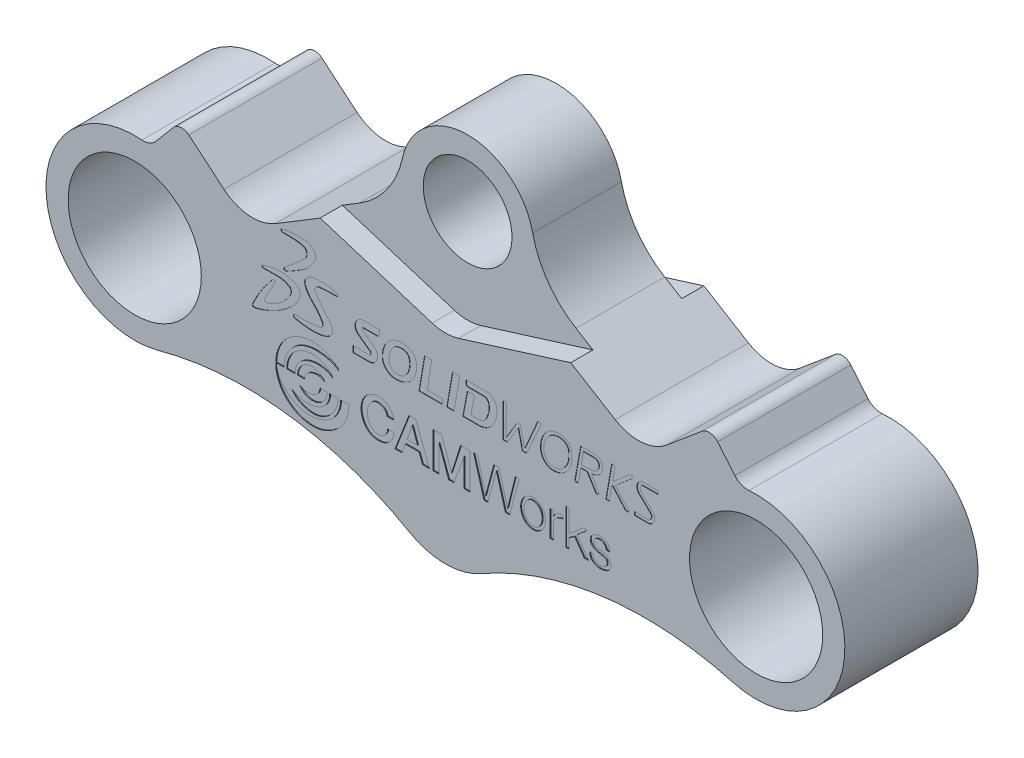
from build123d import *

# Parameters (mm, degrees)
BOSS_EXTRUDE1_DEPTH         = 9.525
FILLET19_R                  = 6.35
FILLET20_R                  = 1.5875
CUT_EXTRUDE2_DEPTH          = 3.175
FILLET9_R                   = 6.35
FILLET14_R                  = 6.35
F_1_2_0_5_DIAMETER_HOLE1_D  = 12.7
F_3_4_0_75_DIAMETER_HOLE1_D = 19.05
CUT_EXTRUDE7_DEPTH          = 0.127
CUT_EXTRUDE9_DEPTH          = 0.0508


with BuildPart() as part:
    # Sketch1 → Boss-Extrude1 (new, symmetric)
    with BuildSketch(Plane.XY):
        with BuildLine():
            Line((41.408094092, 21.341782887), (37.922855541, 25.495328451))
            Line((37.922855541, 25.495328451), (28.194091114, 17.331925808))
            Line((28.194091114, 17.331925808), (15.505038662, 25.045968696))
            ThreePointArc((15.505038662, 25.045968696), (11.511601045, 28.76173019), (9.311946254, 33.753317741))
            ThreePointArc((9.311946254, 33.753317741), (0, 41.275), (-9.311946254, 33.753317741))
            ThreePointArc((-9.311946254, 33.753317741), (-11.511601045, 28.76173019), (-15.505038662, 25.045968696))
            Line((-15.505038662, 25.045968696), (-28.194091114, 17.331925808))
            Line((-28.194091114, 17.331925808), (-37.922855541, 25.495328451))
            Line((-37.922855541, 25.495328451), (-41.408094092, 21.341782887))
            ThreePointArc((-41.408094092, 21.341782887), (-42.315924102, 20.673762154), (-43.429041923, 20.496630161))
            ThreePointArc((-43.429041923, 20.496630161), (-57.093834015, 6.644645276), (-41.079126513, -4.4067425))
            ThreePointArc((-41.079126513, -4.4067425), (-22.650036169, -3.088337931), (-5.129488876, -8.953487892))
            ThreePointArc((-5.129488876, -8.953487892), (0, -10.31875), (5.129488876, -8.953487892))
            ThreePointArc((5.129488876, -8.953487892), (22.650036169, -3.088337931), (41.079126513, -4.4067425))
            ThreePointArc((41.079126513, -4.4067425), (57.093834015, 6.644645276), (43.429041923, 20.496630161))
            ThreePointArc((43.429041923, 20.496630161), (42.315924102, 20.673762154), (41.408094092, 21.341782887))
        make_face()
    extrude(amount=BOSS_EXTRUDE1_DEPTH, both=True)

    # Fillet19
    fillet19_edges = [part.edges().sort_by_distance(p)[0] for p in [
        (28.194091114, 17.331925808, 0),
        (-28.194091114, 17.331925808, 0),
    ]]
    fillet(fillet19_edges, radius=FILLET19_R)

    # Fillet20
    fillet20_edges = [part.edges().sort_by_distance(p)[0] for p in [
        (37.922855541, 25.495328451, 0),
        (-37.922855541, 25.495328451, 0),
    ]]
    fillet(fillet20_edges, radius=FILLET20_R)

    # Sketch3 → Cut-Extrude2 (cut)
    with BuildSketch(Plane.XY.offset(9.525)):
        Polygon((-13.038987616, 44.246461893), (13.038987616, 44.246461893), (19.347324486, 24.017827298), (0, 17.984328605), (-19.347324486, 24.017827298), align=None)
    cut_extrude2 = extrude(amount=-CUT_EXTRUDE2_DEPTH, mode=Mode.SUBTRACT)

    # Fillet9
    fillet9_edges = [part.edges().sort_by_distance(p)[0] for p in [
        (0, 17.984328605, 7.9375),
    ]]
    fillet(fillet9_edges, radius=FILLET9_R)

    # Mirror13: Cut-Extrude2 across plane
    add(cut_extrude2.mirror(Plane.XY), mode=Mode.SUBTRACT)

    # Fillet14
    fillet14_edges = [part.edges().sort_by_distance(p)[0] for p in [
        (0, 17.984328605, -7.9375),
    ]]
    fillet(fillet14_edges, radius=FILLET14_R)

    # 1/2 (0.5) Diameter Hole1 (through all)
    with Locations(Plane.XY.offset(6.35)):
        with Locations((0, 31.75)):
            Hole(F_1_2_0_5_DIAMETER_HOLE1_D / 2)

    # 3/4 (0.75) Diameter Hole1 (through all)
    with Locations(Plane.XY.offset(9.525)):
        with Locations((-44.45, 7.837734292), (44.45, 7.837734292)):
            Hole(F_3_4_0_75_DIAMETER_HOLE1_D / 2)

    # Sketch20 → Cut-Extrude7 (cut)
    # profile 1 of 14: a face of its own
    with BuildSketch(Plane.XY.offset(9.525)):
        with BuildLine():
            add(Edge.make_bspline(
                [(-15.154845135, 5.962788169), (-15.578325694, 6.549836748), (-16.837528358, 7.448350373), (-18.961648523, 7.893001053), (-21.069184277, 7.44815324), (-23.412076262, 5.965768414), (-24.265528194, 3.858612653), (-24.26129315, 2.50635141)],
                knots=[0, 0, 0, 0, 0.17213689, 0.357725167, 0.501202943, 0.677745934, 1, 1, 1, 1], degree=3))
            Line((-24.26129315, 2.50635141), (-23.102441304, 2.50635141))
            add(Edge.make_bspline(
                [(-23.102441304, 2.50635141), (-23.097069308, 3.585922671), (-22.465123157, 5.225124628), (-20.549082761, 6.630138944), (-18.078018823, 7.11116476), (-16.196628222, 6.603943369), (-15.154845135, 5.962788169)],
                knots=[0, 0, 0, 0, 0.304366873, 0.466255188, 0.655370709, 1, 1, 1, 1], degree=3))
        make_face()
    # profile 2 of 14: a face of its own
    with BuildSketch(Plane.XY.offset(9.525)):
        with BuildLine():
            add(Edge.make_bspline(
                [(-17.245831982, 3.573554363), (-17.405493774, 3.905784033), (-17.976863302, 4.443993085), (-19.102146716, 4.703055663), (-20.533477397, 4.26164477), (-21.166460236, 3.22922874), (-21.137142585, 2.50635141)],
                knots=[0, 0, 0, 0, 0.202686739, 0.415279372, 0.607942049, 1, 1, 1, 1], degree=3))
            Line((-21.137142585, 2.50635141), (-20.130284256, 2.50635141))
            add(Edge.make_bspline(
                [(-20.130284256, 2.50635141), (-20.132402551, 2.959336263), (-19.632556635, 3.697544249), (-18.387076421, 4.036630122), (-17.576838627, 3.870423003), (-17.245831982, 3.573554363)],
                knots=[0, 0, 0, 0, 0.355167201, 0.653312356, 1, 1, 1, 1], degree=3))
        make_face()
    # profile 3 of 14: a face of its own
    with BuildSketch(Plane.XY.offset(9.525)):
        with BuildLine():
            add(Edge.make_bspline(
                [(-16.102800636, 4.673722033), (-16.659437016, 5.444632506), (-18.079126836, 6.325446328), (-20.165970666, 6.088538818), (-22.036821611, 5.05274492), (-22.715448931, 3.5248993), (-22.698757178, 2.50635141)],
                knots=[0, 0, 0, 0, 0.31313644, 0.50236644, 0.666443794, 1, 1, 1, 1], degree=3))
            Line((-22.698757178, 2.50635141), (-21.501624941, 2.50635141))
            add(Edge.make_bspline(
                [(-21.501624941, 2.50635141), (-21.58787462, 3.339798662), (-20.852406345, 4.588240409), (-19.121551814, 5.300006211), (-17.541941229, 5.311625203), (-16.553941295, 4.965750914), (-16.102800636, 4.673722033)],
                knots=[0, 0, 0, 0, 0.336821708, 0.56234389, 0.77094482, 1, 1, 1, 1], degree=3))
        make_face()
    # profile 4 of 14: a face of its own
    with BuildSketch(Plane.XY.offset(9.525)):
        with BuildLine():
            add(Edge.make_bspline(
                [(-20.829642183, 1.435482139), (-20.572440719, 0.981143184), (-19.817018621, 0.39467993), (-18.506105431, 0.377938727), (-17.301557854, 1.001109629), (-16.936098719, 1.96152892), (-16.928176734, 2.50635141)],
                knots=[0, 0, 0, 0, 0.28773554, 0.487574045, 0.695315024, 1, 1, 1, 1], degree=3))
            Line((-16.928176734, 2.50635141), (-17.959997916, 2.50635141))
            add(Edge.make_bspline(
                [(-17.959997916, 2.50635141), (-17.932048156, 1.82229001), (-19.008250224, 0.918546675), (-20.325645903, 1.043272546), (-20.829642183, 1.435482139)],
                knots=[0, 0, 0, 0, 0.49957784, 1, 1, 1, 1], degree=3))
        make_face()
    # profile 5 of 14: a face of its own
    with BuildSketch(Plane.XY.offset(9.525)):
        with BuildLine():
            add(Edge.make_bspline(
                [(-21.960424075, 0.342894049), (-21.534887241, -0.33617705), (-20.396288729, -1.012603155), (-18.535853049, -1.270982252), (-16.953146819, -0.656844224), (-15.733028159, 0.67661153), (-15.315960834, 1.862935087), (-15.408189038, 2.50635141)],
                knots=[0, 0, 0, 0, 0.257454808, 0.416874859, 0.605260486, 0.789877863, 1, 1, 1, 1], degree=3))
            Line((-15.408189038, 2.50635141), (-16.561806986, 2.50635141))
            add(Edge.make_bspline(
                [(-16.561806986, 2.50635141), (-16.511471384, 1.837059498), (-16.970201644, 0.679921892), (-18.401425093, -0.117874782), (-20.081264669, -0.401578151), (-21.309848105, -0.079997861), (-21.960424075, 0.342894049)],
                knots=[0, 0, 0, 0, 0.283056269, 0.482539175, 0.671247526, 1, 1, 1, 1], degree=3))
        make_face()
    # profile 6 of 14: a face of its own
    with BuildSketch(Plane.XY.offset(9.525)):
        with BuildLine():
            add(Edge.make_bspline(
                [(15.441899323, 2.693396798), (15.602035462, 2.902756432), (15.892726972, 3.462988431), (16.505400437, 3.609425693), (16.816078844, 3.615328702)],
                knots=[0, 0, 0, 0, 0.469307206, 1, 1, 1, 1], degree=3))
            Line((16.816078844, 3.615328702), (16.816078844, 4.127474505))
            add(Edge.make_bspline(
                [(16.816078844, 4.127474505), (16.275543308, 4.160186671), (15.691235328, 3.837714188), (15.441899323, 3.313429427)],
                knots=[0, 0, 0, 0, 1, 1, 1, 1], degree=3))
            Line((15.441899323, 3.313429427), (15.441899323, 4.031351101))
            Line((15.441899323, 4.031351101), (14.97561702, 4.031351101))
            Line((14.97561702, 4.031351101), (14.97561702, 0.3485751))
            Line((14.97561702, 0.3485751), (15.441899323, 0.3485751))
            Line((15.441899323, 0.3485751), (15.441899323, 2.693396798))
        make_face()
    # profile 7 of 14: a face of its own
    with BuildSketch(Plane.XY.offset(9.525)):
        with BuildLine():
            add(Edge.make_bspline(
                [(20.67107786, 1.528216872), (20.613953375, 1.221655034), (20.797858839, 0.647667647), (21.670749301, 0.165116883), (22.628151326, 0.131819602), (23.655705249, 0.624849989), (23.804693391, 1.669908639), (23.003932649, 2.450890522), (22.141467227, 2.455105406), (21.281007437, 2.701487333), (21.206579975, 3.530333453), (21.845868185, 3.724427066), (22.610636197, 3.788981938), (23.027282351, 3.128969869), (23.036675624, 2.906141513)],
                knots=[0, 0, 0, 0, 0.091070615, 0.156874293, 0.280394799, 0.36488583, 0.466496103, 0.536468143, 0.665478679, 0.716572617, 0.778127638, 0.846119657, 0.890812251, 1, 1, 1, 1], degree=3))
            Line((23.036675624, 2.906141513), (23.49122029, 2.906141513))
            add(Edge.make_bspline(
                [(23.49122029, 2.906141513), (23.50687304, 3.302073861), (23.43770383, 3.574529519), (22.817415308, 4.130123172), (22.063336854, 4.200612601), (21.439105471, 4.112384908), (20.79617851, 3.6676207), (20.604844787, 2.868148864), (21.420153209, 2.029246431), (22.299125952, 2.019386461), (23.104530145, 1.719891976), (23.279304278, 1.022216597), (22.557776527, 0.550353966), (21.619512601, 0.581079625), (21.000875285, 1.120489437), (21.119649084, 1.528216872)],
                knots=[0, 0, 0, 0, 0.067061893, 0.148974799, 0.203040078, 0.28681956, 0.328691497, 0.425200419, 0.488568397, 0.640215096, 0.674333456, 0.728187294, 0.813903484, 0.886702844, 1, 1, 1, 1], degree=3))
            Line((21.119649084, 1.528216872), (20.67107786, 1.528216872))
        make_face()
    # profile 8 of 14: a face of its own
    with BuildSketch(Plane.XY.offset(9.525)):
        with BuildLine():
            add(Edge.make_bspline(
                [(-8.253737619, 2.278747085), (-8.261737772, 1.726367618), (-8.894810308, 0.803328862), (-10.146225272, 0.954264904), (-10.822225065, 1.514190474), (-11.231846307, 2.528922229), (-11.160611268, 3.826486548), (-10.127154363, 4.983623712), (-8.783774058, 4.762476757), (-8.363145772, 4.08237895), (-8.346465372, 3.792109582)],
                knots=[0, 0, 0, 0, 0.179682053, 0.286072628, 0.363963482, 0.4521715, 0.627882231, 0.757862959, 0.910918307, 1, 1, 1, 1], degree=3))
            Line((-8.346465372, 3.792109582), (-7.409708046, 3.792109582))
            add(Edge.make_bspline(
                [(-7.409708046, 3.792109582), (-7.461206133, 4.665433762), (-8.60299766, 5.763666694), (-10.334564404, 5.595248979), (-11.617114969, 4.812707555), (-12.19649888, 3.344718515), (-11.934060251, 1.63556273), (-11.070868107, 0.46369399), (-9.677060812, 0.085191867), (-8.29345954, 0.305226166), (-7.493922171, 1.389534833), (-7.351601244, 2.056390727), (-7.374414812, 2.278747085)],
                knots=[0, 0, 0, 0, 0.175330696, 0.271236919, 0.338579899, 0.473109905, 0.57073625, 0.688740776, 0.747216662, 0.858562083, 0.957456763, 1, 1, 1, 1], degree=3))
            Line((-7.374414812, 2.278747085), (-8.253737619, 2.278747085))
        make_face()
    # profile 9 of 14: a face of its own
    with BuildSketch(Plane.XY.offset(9.525)):
        Polygon((1.210832331, 0.3485751), (2.681056399, 4.343364089), (2.681056399, 0.3485751), (3.493396608, 0.3485751), (3.493396608, 5.457765475), (2.178928778, 5.457765475), (0.889354837, 1.40777763), (-0.57144251, 5.461001415), (-1.763817842, 5.461001415), (-1.763817842, 0.3485751), (-0.919861843, 0.3485751), (-0.919861843, 4.212080427), (0.472560247, 0.3485751), align=None)
    # profile 10 of 14: a face of its own
    with BuildSketch(Plane.XY.offset(9.525)):
        with BuildLine():
            add(Edge.make_bspline(
                [(-14.997707795, 2.50635141), (-14.98648072, 1.545350159), (-15.729691015, -0.601005149), (-18.510422409, -1.76504958), (-21.465048224, -1.422639309), (-23.60016443, 0.183714613), (-24.167802042, 1.926466653), (-24.206631157, 2.489048279)],
                knots=[0.001261012, 0.001261012, 0.001261012, 0.001261012, 0.216474276, 0.470315596, 0.597834181, 0.876935572, 1, 1, 1, 1], degree=3))
            Line((-24.206631157, 2.489048279), (-24.261798656, 2.489048279))
            add(Edge.make_bspline(
                [(-24.261798656, 2.489048279), (-24.269621802, 2.203115398), (-24.21864849, 1.407758141), (-23.839857018, 0.20666636), (-22.824455842, -1.274247865), (-20.904580847, -2.645070192), (-18.171617334, -2.928579089), (-16.051476509, -1.889375611), (-14.327745425, -0.224233421), (-13.777862041, 1.416031905), (-13.802751288, 2.50635141)],
                knots=[0, 0, 0, 0, 0.05256655, 0.14551147, 0.227178518, 0.378977625, 0.564372139, 0.699237559, 0.80001659, 0.998939544, 0.998939544, 0.998939544, 0.998939544], degree=3))
            Line((-13.802751288, 2.50635141), (-14.997707795, 2.50635141))
        make_face()
    # profile 11 of 14: a face of its own
    with BuildSketch(Plane.XY.offset(9.525)):
        Polygon((-6.239149138, 0.3485751), (-5.728469786, 1.660665445), (-3.755280049, 1.660665445), (-3.260193959, 0.3485751), (-2.295667713, 0.3485751), (-4.224720206, 5.461001415), (-5.212030536, 5.461001415), (-7.201840588, 0.3485751), align=None)
        Polygon((-5.468142485, 2.391298414), (-4.741874917, 4.510218278), (-3.988781582, 2.391298414), align=None, mode=Mode.SUBTRACT)
    # profile 12 of 14: a face of its own
    with BuildSketch(Plane.XY.offset(9.525)):
        Polygon((17.215169145, 5.461001415), (17.215169145, 0.3485751), (17.691619779, 0.3485751), (17.691619779, 1.761807623), (18.469498994, 2.316524438), (19.872871869, 0.3485751), (20.48534593, 0.3485751), (18.813219975, 2.693396798), (20.335561706, 4.007401655), (19.70180655, 4.007401655), (17.691619779, 2.272314765), (17.691619779, 5.461001415), align=None)
    # profile 13 of 14: a face of its own
    with BuildSketch(Plane.XY.offset(9.525)):
        Polygon((4.613634742, 5.457765475), (4.032825664, 5.457765475), (5.522013992, 0.3485751), (6.050635431, 0.3485751), (7.288694063, 4.831779715), (8.595424777, 0.3485751), (9.181625449, 0.3485751), (10.546284711, 5.461001415), (10.000749439, 5.461001415), (8.888525113, 0.9777968), (7.667385634, 5.461001415), (6.9340126, 5.461001415), (5.737311401, 0.9777968), align=None)
    # profile 14 of 14: a face of its own
    with BuildSketch(Plane.XY.offset(9.525)):
        with BuildLine():
            add(Edge.make_bspline(
                [(12.459760097, 0.197683891), (15.538295891, 0.068210118), (14.125596955, 3.142414219), (12.712898018, 6.216618319), (11.047061161, 3.271887992), (9.381224303, 0.327157664), (12.459760097, 0.197683891)],
                knots=[0, 0, 0, 2.094395102, 2.094395102, 4.188790205, 4.188790205, 6.283185307, 6.283185307, 6.283185307], degree=2, weights=[1, 0.5, 1, 0.5, 1, 0.5, 1]))
        make_face()
        with BuildLine():
            add(Edge.make_bspline(
                [(12.544139404, 3.792109582), (10.270503805, 3.792109582), (11.407321604, 1.40993826), (12.544139404, -0.972233063), (13.680957204, 1.40993826), (14.817775004, 3.792109582), (12.544139404, 3.792109582)],
                knots=[0, 0, 0, 2.094395102, 2.094395102, 4.188790205, 4.188790205, 6.283185307, 6.283185307, 6.283185307], degree=2, weights=[1, 0.5, 1, 0.5, 1, 0.5, 1]))
        make_face(mode=Mode.SUBTRACT)
    extrude(amount=-CUT_EXTRUDE7_DEPTH, mode=Mode.SUBTRACT)

    # Sketch22 → Cut-Extrude9 (cut)
    # profile 1 of 13: a face of its own
    with BuildSketch(Plane.XY.offset(9.525)):
        with BuildLine():
            add(Edge.make_bspline(
                [(-6.327227707, 13.98099488), (-6.892418819, 13.941336041), (-7.837941125, 13.606200654), (-8.656637104, 12.599626065), (-9.023613545, 11.512977465), (-9.13228307, 10.188477062), (-8.31716132, 9.312819274), (-7.261084599, 8.928536198), (-6.153509311, 9.073071649), (-4.844950051, 9.760553078), (-4.156198652, 11.105425367), (-4.023008951, 12.544566088), (-4.628729918, 13.560320366), (-5.454753741, 13.952698573), (-5.995744906, 14.004254664), (-6.327227707, 13.98099488)],
                knots=[0, 0, 0, 0, 0.108437372, 0.182277357, 0.243087303, 0.330527441, 0.425194381, 0.446032953, 0.5477977, 0.628437139, 0.724076823, 0.826878908, 0.896495288, 0.936401824, 1, 1, 1, 1], degree=3))
        make_face()
        with BuildLine():
            add(Edge.make_bspline(
                [(-6.342709592, 13.224241614), (-6.684772844, 13.203135765), (-7.227033881, 13.085742272), (-7.687908942, 12.507893936), (-7.899013457, 12.003011627), (-8.041528632, 11.499426015), (-8.05154879, 11.144407037), (-8.050373721, 10.814760413), (-8.035907066, 10.402222327), (-7.72110397, 9.968019534), (-7.099668959, 9.729441371), (-6.370538156, 9.698770427), (-5.564583762, 10.223549685), (-5.119834696, 11.178636366), (-5.043606515, 12.123450414), (-5.268843296, 12.844363123), (-5.617918173, 13.079786873), (-5.953567066, 13.232189936), (-6.210485367, 13.23240006), (-6.342709592, 13.224241614)],
                knots=[0, 0, 0, 0, 0.097807515, 0.150245541, 0.208881987, 0.257422323, 0.302121709, 0.311658493, 0.352790166, 0.422067893, 0.450224506, 0.546400305, 0.621191585, 0.717547723, 0.842550186, 0.893983943, 0.925618741, 0.962192598, 1, 1, 1, 1], degree=3))
        make_face(mode=Mode.SUBTRACT)
    # profile 2 of 13: a face of its own
    with BuildSketch(Plane.XY.offset(9.525)):
        Polygon((-2.981655961, 13.98099488), (-3.771990861, 9.224872356), (-0.494452815, 9.224872356), (-0.37681203, 9.932817795), (-2.626660968, 9.932817795), (-1.953966853, 13.98099488), align=None)
    # profile 3 of 13: a face of its own
    with BuildSketch(Plane.XY.offset(9.525)):
        Polygon((1.021138835, 13.98099488), (2.049933801, 13.98099488), (1.230502596, 9.224872356), (0.20170763, 9.224872356), align=None)
    # profile 4 of 13: a face of its own
    with BuildSketch(Plane.XY.offset(9.525)):
        with BuildLine():
            Line((3.131437911, 12.63463459), (4.147591219, 12.63463459))
            Line((4.147591219, 12.63463459), (3.647489464, 9.968672777))
            Line((3.647489464, 9.968672777), (4.830989687, 9.968672777))
            ThreePointArc((4.830989687, 9.968672777), (5.464663164, 10.16714974), (5.871887341, 10.691652981))
            ThreePointArc((5.871887341, 10.691652981), (6.061920315, 11.139553428), (6.204732421, 11.604668515))
            ThreePointArc((6.204732421, 11.604668515), (6.259642102, 12.199280867), (6.131532553, 12.782519124))
            ThreePointArc((6.131532553, 12.782519124), (5.888495119, 13.088986008), (5.514838785, 13.204615109))
            Line((5.514838785, 13.204615109), (3.261432825, 13.204615109))
            ThreePointArc((3.261432825, 13.204615109), (3.091153867, 13.256353096), (2.978441175, 13.394075978))
            Line((2.978441175, 13.394075978), (2.978441175, 13.98099488))
            Line((2.978441175, 13.98099488), (5.702943969, 13.98099488))
            ThreePointArc((5.702943969, 13.98099488), (6.049298011, 13.951824465), (6.385894177, 13.865135041))
            ThreePointArc((6.385894177, 13.865135041), (6.865766966, 13.576285808), (7.190050987, 13.119611256))
            ThreePointArc((7.190050987, 13.119611256), (7.385003109, 12.354486571), (7.325850808, 11.567134604))
            ThreePointArc((7.325850808, 11.567134604), (7.082922578, 10.86230367), (6.711658758, 10.215802358))
            ThreePointArc((6.711658758, 10.215802358), (5.868865814, 9.482380116), (4.783313131, 9.218214441))
            Line((4.783313131, 9.218214441), (2.490559371, 9.218214441))
            Line((2.490559371, 9.218214441), (3.131437911, 12.63463459))
        make_face()
    # profile 5 of 13: a face of its own
    with BuildSketch(Plane.XY.offset(9.525)):
        with BuildLine():
            Line((-9.411192675, 13.98099488), (-11.733865385, 13.98099488))
            ThreePointArc((-11.733865385, 13.98099488), (-12.865007326, 13.159490251), (-12.433741638, 11.829692578))
            Line((-12.433741638, 11.829692578), (-10.788049407, 10.632174754))
            ThreePointArc((-10.788049407, 10.632174754), (-10.68072848, 10.340737613), (-10.908850447, 10.129991898))
            Line((-10.908850447, 10.129991898), (-13.193321861, 10.129991898))
            Line((-13.193321861, 10.129991898), (-13.193321861, 9.259913225))
            Line((-13.193321861, 9.259913225), (-10.952540436, 9.259913225))
            ThreePointArc((-10.952540436, 9.259913225), (-9.765906277, 10.130970661), (-10.241318887, 11.524105447))
            Line((-10.241318887, 11.524105447), (-11.839274936, 12.686887171))
            ThreePointArc((-11.839274936, 12.686887171), (-11.920188148, 12.881912991), (-11.783573702, 13.042905262))
            Line((-11.783573702, 13.042905262), (-9.651966546, 13.042905262))
            Line((-9.651966546, 13.042905262), (-9.411192675, 13.355652447))
            Line((-9.411192675, 13.355652447), (-9.411192675, 13.98099488))
        make_face()
    # profile 6 of 13: a face of its own
    with BuildSketch(Plane.XY.offset(9.525)):
        Polygon((8.245611292, 13.98099488), (8.245611292, 9.188099975), (8.875278067, 9.188099975), (10.422237182, 11.76882994), (10.99748831, 9.188099975), (11.603834093, 9.188099975), (13.701312884, 13.793521065), (13.659524505, 13.98099488), (13.232786978, 13.98099488), (11.389406362, 9.722722206), (11.300661201, 9.722722206), (10.730465896, 12.280770402), (10.24497423, 12.280770402), (8.763938904, 9.810018454), (8.670419954, 9.810018454), (8.717179429, 13.98099488), align=None)
    # profile 7 of 13: a face of its own
    with BuildSketch(Plane.XY.offset(9.525)):
        with BuildLine():
            Line((19.355876074, 13.949663892), (18.497893152, 9.188099975))
            Line((18.497893152, 9.188099975), (19.000885535, 9.188099975))
            Line((19.000885535, 9.188099975), (19.37106672, 11.242501445))
            Line((19.37106672, 11.242501445), (20.287651007, 11.242501445))
            Line((20.287651007, 11.242501445), (21.544318716, 9.188099975))
            Line((21.544318716, 9.188099975), (21.876483498, 9.188099975))
            Line((21.876483498, 9.188099975), (21.971387721, 9.259913225))
            Line((21.971387721, 9.259913225), (21.971387721, 9.44553875))
            Line((21.971387721, 9.44553875), (20.932186477, 11.144425852))
            Line((20.932186477, 11.144425852), (20.932186477, 11.281573036))
            ThreePointArc((20.932186477, 11.281573036), (21.253148974, 11.353342841), (21.562538149, 11.464905238))
            ThreePointArc((21.562538149, 11.464905238), (21.668794477, 11.515196372), (21.771509581, 11.572373402))
            ThreePointArc((21.771509581, 11.572373402), (22.389268387, 12.3132356), (22.413644351, 13.277553262))
            ThreePointArc((22.413644351, 13.277553262), (22.062923722, 13.763759443), (21.492975527, 13.949663892))
            Line((21.492975527, 13.949663892), (19.355876074, 13.949663892))
        make_face()
        with BuildLine():
            Line((19.719305172, 13.46932146), (19.454981613, 11.722523223))
            Line((19.454981613, 11.722523223), (20.327389526, 11.722523223))
            ThreePointArc((20.327389526, 11.722523223), (20.727197513, 11.739009364), (21.124290882, 11.78835585))
            ThreePointArc((21.124290882, 11.78835585), (21.736507758, 12.138822579), (21.972247258, 12.803701003))
            ThreePointArc((21.972247258, 12.803701003), (21.971818688, 12.820523832), (21.971015805, 12.837332956))
            ThreePointArc((21.971015805, 12.837332956), (21.761327536, 13.286412808), (21.300690684, 13.46932146))
            Line((21.300690684, 13.46932146), (19.719305172, 13.46932146))
        make_face(mode=Mode.SUBTRACT)
    # profile 8 of 13: a face of its own
    with BuildSketch(Plane.XY.offset(9.525)):
        Polygon((23.789909669, 13.949658937), (22.967837997, 9.188099975), (23.456919121, 9.188099975), (23.818352196, 11.281573036), (23.946000245, 11.281573036), (25.767046983, 9.188099975), (26.162474275, 9.188099975), (26.26049425, 9.381261212), (24.297369568, 11.526649411), (26.803091454, 13.700890557), (26.803091454, 13.949663892), (26.386543327, 13.949663892), (23.946000245, 11.831979076), (24.234378003, 13.825277225), (24.126450687, 13.949658937), align=None)
    # profile 9 of 13: a face of its own
    with BuildSketch(Plane.XY.offset(9.525)):
        with BuildLine():
            Line((30.431527076, 13.949663892), (28.177082316, 13.949663892))
            ThreePointArc((28.177082316, 13.949663892), (27.989899949, 13.917881368), (27.823698677, 13.826096269))
            ThreePointArc((27.823698677, 13.826096269), (27.405294954, 13.004083441), (27.750508491, 12.148750536))
            Line((27.750508491, 12.148750536), (29.293818169, 10.681982558))
            ThreePointArc((29.293818169, 10.681982558), (29.47973215, 10.263740712), (29.315587895, 9.836485619))
            ThreePointArc((29.315587895, 9.836485619), (29.145805436, 9.718769046), (28.943153867, 9.678574311))
            Line((28.943153867, 9.678574311), (27.04827258, 9.696417213))
            Line((27.04827258, 9.696417213), (27.043967607, 9.239237481))
            Line((27.043967607, 9.239237481), (28.938848894, 9.221394579))
            ThreePointArc((28.938848894, 9.221394579), (29.324277655, 9.297842084), (29.647191724, 9.52173057))
            ThreePointArc((29.647191724, 9.52173057), (29.936780675, 10.275508728), (29.608784822, 11.013385406))
            Line((29.608784822, 11.013385406), (28.065475145, 12.480153383))
            ThreePointArc((28.065475145, 12.480153383), (27.862060327, 12.984152701), (28.108601983, 13.468518381))
            ThreePointArc((28.108601983, 13.468518381), (28.140809242, 13.486304926), (28.177082316, 13.492463892))
            Line((28.177082316, 13.492463892), (30.431527076, 13.492463892))
            Line((30.431527076, 13.492463892), (30.431527076, 13.949663892))
        make_face()
    # profile 10 of 13: a face of its own
    with BuildSketch(Plane.XY.offset(9.525)):
        with BuildLine():
            Line((-23.038987465, 14.907775389), (-21.862660542, 15.87328674))
            ThreePointArc((-21.862660542, 15.87328674), (-20.935890521, 16.678624248), (-20.055852546, 17.534780972))
            ThreePointArc((-20.055852546, 17.534780972), (-19.823878757, 18.172011085), (-20.145836732, 18.768850358))
            ThreePointArc((-20.145836732, 18.768850358), (-20.225373428, 18.819300991), (-20.312580885, 18.85488486))
            ThreePointArc((-20.312580885, 18.85488486), (-20.901205042, 18.997297529), (-21.502800906, 19.066883337))
            ThreePointArc((-21.502800906, 19.066883337), (-22.395710721, 19.101036892), (-23.289254004, 19.106936562))
            ThreePointArc((-23.289254004, 19.106936562), (-23.307872831, 19.107430502), (-23.326408856, 19.109252726))
            ThreePointArc((-23.326408856, 19.109252726), (-23.513236325, 19.318627486), (-23.334945161, 19.535317482))
            ThreePointArc((-23.334945161, 19.535317482), (-22.722704062, 19.635411541), (-22.108282109, 19.721106625))
            ThreePointArc((-22.108282109, 19.721106625), (-21.790311413, 19.753599595), (-21.47111393, 19.7701563))
            ThreePointArc((-21.47111393, 19.7701563), (-20.845576707, 19.775462664), (-20.220265465, 19.757832413))
            ThreePointArc((-20.220265465, 19.757832413), (-19.672244053, 19.664325474), (-19.169917273, 19.426126354))
            ThreePointArc((-19.169917273, 19.426126354), (-18.991119477, 19.290450077), (-18.832826067, 19.131327796))
            ThreePointArc((-18.832826067, 19.131327796), (-18.570729767, 18.541318199), (-18.681589299, 17.905302508))
            ThreePointArc((-18.681589299, 17.905302508), (-19.52964736, 16.684475271), (-20.680665881, 15.743848895))
            ThreePointArc((-20.680665881, 15.743848895), (-21.652800458, 15.170723761), (-22.639711715, 14.623435696))
            ThreePointArc((-22.639711715, 14.623435696), (-22.825505108, 14.576673165), (-23.011298501, 14.623435696))
            ThreePointArc((-23.011298501, 14.623435696), (-23.101027967, 14.758215872), (-23.038987465, 14.907775389))
        make_face()
    # profile 11 of 13: a face of its own
    with BuildSketch(Plane.XY.offset(9.525)):
        with BuildLine():
            ThreePointArc((-24.754196419, 12.515219448), (-26.345986559, 10.402884871), (-27.614892709, 8.082188769))
            ThreePointArc((-27.614892709, 8.082188769), (-27.591500113, 7.866403812), (-27.390875233, 7.783578583))
            ThreePointArc((-27.390875233, 7.783578583), (-26.915201874, 7.871007001), (-26.447453423, 7.993971465))
            ThreePointArc((-26.447453423, 7.993971465), (-23.96037017, 9.090568364), (-21.807079106, 10.749316523))
            ThreePointArc((-21.807079106, 10.749316523), (-21.213530042, 11.501744377), (-20.82625379, 12.378365886))
            ThreePointArc((-20.82625379, 12.378365886), (-20.784552036, 12.753612089), (-20.877252409, 13.119611255))
            ThreePointArc((-20.877252409, 13.119611255), (-21.184320371, 13.532936802), (-21.634003399, 13.783763267))
            ThreePointArc((-21.634003399, 13.783763267), (-21.944338553, 13.873746001), (-22.257243716, 13.954338545))
            ThreePointArc((-22.257243716, 13.954338545), (-23.970991033, 14.112319731), (-25.658291059, 13.77334105))
            ThreePointArc((-25.658291059, 13.77334105), (-25.903418429, 13.68458418), (-26.147819531, 13.593846585))
            ThreePointArc((-26.147819531, 13.593846585), (-26.231200139, 13.47704397), (-26.154651794, 13.355653988))
            ThreePointArc((-26.154651794, 13.355653988), (-25.987209135, 13.303985588), (-25.812336183, 13.292755367))
            ThreePointArc((-25.812336183, 13.292755367), (-24.736485865, 13.321510815), (-23.660636213, 13.292730471))
            ThreePointArc((-23.660636213, 13.292730471), (-23.165872501, 13.216197868), (-22.696172551, 13.042905262))
            ThreePointArc((-22.696172551, 13.042905262), (-22.507435595, 12.948621228), (-22.320592327, 12.850638012))
            ThreePointArc((-22.320592327, 12.850638012), (-22.20524134, 12.75565181), (-22.134939692, 12.62379618))
            ThreePointArc((-22.134939692, 12.62379618), (-22.099705903, 12.216566021), (-22.231640586, 11.829692578))
            ThreePointArc((-22.231640586, 11.829692578), (-23.485283445, 10.353345634), (-25.155319014, 9.37242672))
            ThreePointArc((-25.155319014, 9.37242672), (-25.397923934, 9.298789817), (-25.648314716, 9.258990368))
            ThreePointArc((-25.648314716, 9.258990368), (-25.838834912, 9.343364335), (-25.868300821, 9.549637628))
            ThreePointArc((-25.868300821, 9.549637628), (-25.505293738, 10.345610535), (-25.067323755, 11.102927712))
            ThreePointArc((-25.067323755, 11.102927712), (-24.694474063, 11.758976414), (-24.396928027, 12.452433803))
            ThreePointArc((-24.396928027, 12.452433803), (-24.404704589, 12.549297627), (-24.48314991, 12.60665098))
            ThreePointArc((-24.48314991, 12.60665098), (-24.631005199, 12.597493225), (-24.754196419, 12.515219448))
        make_face()
    # profile 12 of 13: a face of its own
    with BuildSketch(Plane.XY.offset(9.525)):
        with BuildLine():
            ThreePointArc((18.011848044, 11.046635095), (18.117741528, 11.826584404), (18.073248047, 12.612430881))
            ThreePointArc((18.073248047, 12.612430881), (17.937143133, 13.032880864), (17.675148589, 13.388776346))
            ThreePointArc((17.675148589, 13.388776346), (17.385261782, 13.62871605), (17.059316238, 13.816771694))
            ThreePointArc((17.059316238, 13.816771694), (16.240188016, 13.963180535), (15.419561031, 13.825420081))
            ThreePointArc((15.419561031, 13.825420081), (14.681372726, 13.41598508), (14.120074591, 12.785506376))
            ThreePointArc((14.120074591, 12.785506376), (13.879689757, 12.327525884), (13.711005001, 11.838571437))
            ThreePointArc((13.711005001, 11.838571437), (13.614798535, 11.277289349), (13.617074795, 10.70782637))
            ThreePointArc((13.617074795, 10.70782637), (13.825315759, 9.980867067), (14.28608354, 9.381261212))
            ThreePointArc((14.28608354, 9.381261212), (14.665647295, 9.1295429), (15.100509483, 8.994170708))
            ThreePointArc((15.100509483, 8.994170708), (16.268773328, 9.091100889), (17.256898359, 9.721850282))
            ThreePointArc((17.256898359, 9.721850282), (17.479415212, 9.979233362), (17.676723179, 10.256414468))
            ThreePointArc((17.676723179, 10.256414468), (17.878031476, 10.637213489), (18.011848044, 11.046635095))
        make_face()
        with BuildLine():
            ThreePointArc((15.571133141, 13.394075978), (16.227337278, 13.506014423), (16.883541415, 13.394075978))
            ThreePointArc((16.883541415, 13.394075978), (17.132808069, 13.247359107), (17.355089138, 13.062289306))
            ThreePointArc((17.355089138, 13.062289306), (17.530312967, 12.824263856), (17.62134091, 12.543063893))
            ThreePointArc((17.62134091, 12.543063893), (17.660892638, 11.844498952), (17.566760415, 11.151176199))
            ThreePointArc((17.566760415, 11.151176199), (17.457118461, 10.815718596), (17.292177486, 10.50371277))
            ThreePointArc((17.292177486, 10.50371277), (17.119848424, 10.261622392), (16.925501884, 10.03682364))
            ThreePointArc((16.925501884, 10.03682364), (16.122588869, 9.524300547), (15.173301868, 9.44553875))
            ThreePointArc((15.173301868, 9.44553875), (14.861910597, 9.54247456), (14.590116811, 9.722722206))
            ThreePointArc((14.590116811, 9.722722206), (14.233540595, 10.186741601), (14.072388322, 10.749316523))
            ThreePointArc((14.072388322, 10.749316523), (14.070429196, 11.239440427), (14.153231925, 11.722523223))
            ThreePointArc((14.153231925, 11.722523223), (14.299401104, 12.146213377), (14.507700031, 12.543063893))
            ThreePointArc((14.507700031, 12.543063893), (14.967037661, 13.059015355), (15.571133141, 13.394075978))
        make_face(mode=Mode.SUBTRACT)
    # profile 13 of 13: a face of its own
    with BuildSketch(Plane.XY.offset(9.525)):
        with BuildLine():
            ThreePointArc((-15.662029124, 15.464576643), (-17.283013708, 15.776545661), (-18.930600121, 15.674689393))
            ThreePointArc((-18.930600121, 15.674689393), (-19.521744212, 15.438598074), (-19.981132909, 14.997970711))
            ThreePointArc((-19.981132909, 14.997970711), (-20.134388643, 14.598332156), (-20.079187703, 14.173889992))
            ThreePointArc((-20.079187703, 14.173889992), (-19.607828103, 13.281782408), (-18.954691922, 12.51272523))
            ThreePointArc((-18.954691922, 12.51272523), (-18.232035157, 11.727847093), (-17.62406908, 10.851123797))
            ThreePointArc((-17.62406908, 10.851123797), (-17.544837484, 10.563386484), (-17.62406908, 10.275649171))
            ThreePointArc((-17.62406908, 10.275649171), (-17.80623278, 10.086417847), (-18.053286176, 9.997217361))
            ThreePointArc((-18.053286176, 9.997217361), (-19.775110253, 9.851536366), (-21.502800906, 9.820133988))
            ThreePointArc((-21.502800906, 9.820133988), (-21.725515791, 9.698869145), (-21.736952245, 9.44553875))
            ThreePointArc((-21.736952245, 9.44553875), (-21.699367863, 9.39957688), (-21.645939189, 9.373683714))
            ThreePointArc((-21.645939189, 9.373683714), (-20.9703876, 9.230374337), (-20.288472328, 9.1212914))
            ThreePointArc((-20.288472328, 9.1212914), (-19.077004938, 9.040358249), (-17.865537549, 9.1212914))
            ThreePointArc((-17.865537549, 9.1212914), (-17.234621491, 9.272317692), (-16.64713163, 9.547489776))
            ThreePointArc((-16.64713163, 9.547489776), (-16.437260416, 9.719984941), (-16.287003917, 9.946311016))
            ThreePointArc((-16.287003917, 9.946311016), (-16.1781504, 10.638350196), (-16.455696238, 11.281573036))
            ThreePointArc((-16.455696238, 11.281573036), (-17.553997893, 12.647324882), (-18.619869072, 14.038534163))
            ThreePointArc((-18.619869072, 14.038534163), (-18.711365307, 14.263062998), (-18.68159143, 14.503683601))
            ThreePointArc((-18.68159143, 14.503683601), (-18.477330707, 14.776342945), (-18.163306208, 14.908457194))
            ThreePointArc((-18.163306208, 14.908457194), (-16.921897963, 15.021108939), (-15.675402282, 15.026884898))
            ThreePointArc((-15.675402282, 15.026884898), (-15.540150695, 15.046518778), (-15.420811501, 15.113126869))
            ThreePointArc((-15.420811501, 15.113126869), (-15.369432371, 15.222366701), (-15.420811501, 15.331606532))
            ThreePointArc((-15.420811501, 15.331606532), (-15.535161308, 15.409445884), (-15.662029124, 15.464576643))
        make_face()
    extrude(amount=-CUT_EXTRUDE9_DEPTH, mode=Mode.SUBTRACT)


solid = part.part
